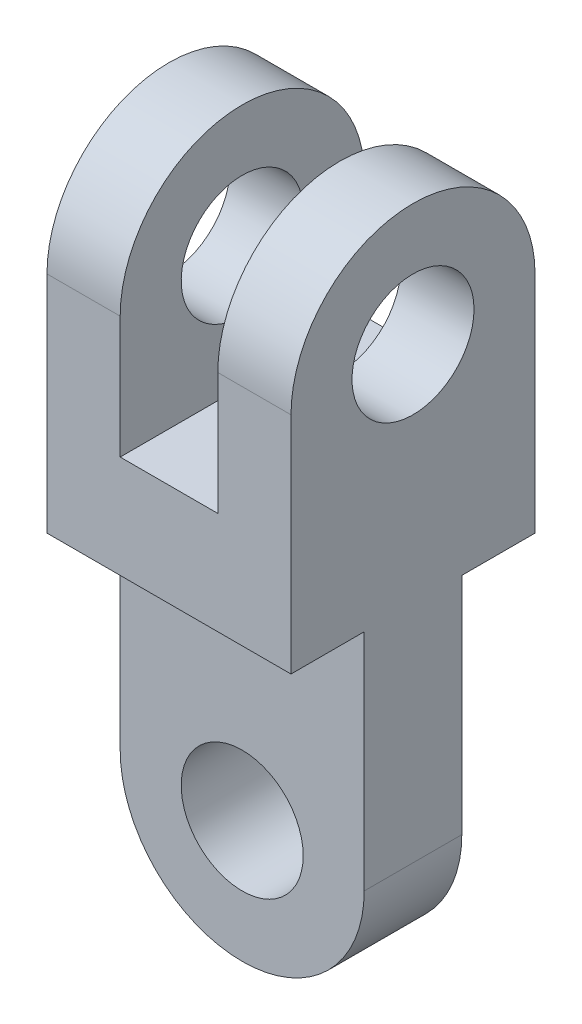
from build123d import *

# Parameters (mm, degrees)
CROQUIS1_R                   = 25
SALIENTE_EXTRUIR1_DEPTH      = 40
SALIENTE_EXTRUIR2_DEPTH      = 30
SALIENTE_EXTRUIR2_DEPTH_BACK = 70
CROQUIS2_W                   = 30
CROQUIS2_H                   = 50
REDONDEO2_RADIUS             = 50
REDONDEO2_LENGTH             = 30
REDONDEO3_RADIUS             = 50
REDONDEO3_LENGTH             = 30
CROQUIS3_R                   = 25
CORTAR_EXTRUIR1_DEPTH        = 264.924231551


with BuildPart() as part:
    # Croquis1 → Saliente-Extruir1 (new body)
    with BuildSketch(Plane.XY):
        with BuildLine():
            Line((-50, 0), (-50, 92))
            Line((-50, 92), (50, 92))
            Line((50, 92), (50, 0))
            ThreePointArc((50, 0), (0, -50), (-50, 0))
        make_face()
        Circle(CROQUIS1_R, mode=Mode.SUBTRACT)
    extrude(amount=-SALIENTE_EXTRUIR1_DEPTH)

    # Croquis2 → Saliente-Extruir2 (add, two sides: drawn at the far end of the back side and taken through both)
    with BuildSketch(Plane.XY.offset(-SALIENTE_EXTRUIR2_DEPTH_BACK)):
        Polygon((50, 184), (50, 92), (-50, 92), (-50, 184), (-20, 184), (-20, 134), (20, 134), (20, 184), align=None)
        with Locations((-35, 209)):
            Rectangle(CROQUIS2_W, CROQUIS2_H)
        with Locations((35, 209)):
            Rectangle(CROQUIS2_W, CROQUIS2_H)
    extrude(amount=SALIENTE_EXTRUIR2_DEPTH + SALIENTE_EXTRUIR2_DEPTH_BACK)

    # Redondeo2: full round fillet: the end face becomes a half cylinder, R = half its width
    redondeo2_face = Plane((-35, 234, -20), x_dir=(1, 0, 0), z_dir=(0, 1, 0))  # on the end face: x along it, z out of the body
    redondeo2_slab = redondeo2_face.offset(-REDONDEO2_RADIUS / 2) * Box(REDONDEO2_LENGTH, 2 * REDONDEO2_RADIUS, REDONDEO2_RADIUS, mode=Mode.PRIVATE)  # the body's end, R deep
    redondeo2_round = Plane((-35, 184, -20), x_dir=(0, 1, 0), z_dir=(1, 0, 0)) * Cylinder(REDONDEO2_RADIUS, REDONDEO2_LENGTH, mode=Mode.PRIVATE)  # its axis R under the face
    add(redondeo2_slab - redondeo2_round, mode=Mode.SUBTRACT)

    # Redondeo3: full round fillet: the end face becomes a half cylinder, R = half its width
    redondeo3_face = Plane((35, 234, -20), x_dir=(1, 0, 0), z_dir=(0, 1, 0))  # on the end face: x along it, z out of the body
    redondeo3_slab = redondeo3_face.offset(-REDONDEO3_RADIUS / 2) * Box(REDONDEO3_LENGTH, 2 * REDONDEO3_RADIUS, REDONDEO3_RADIUS, mode=Mode.PRIVATE)  # the body's end, R deep
    redondeo3_round = Plane((35, 184, -20), x_dir=(0, 1, 0), z_dir=(1, 0, 0)) * Cylinder(REDONDEO3_RADIUS, REDONDEO3_LENGTH, mode=Mode.PRIVATE)  # its axis R under the face
    add(redondeo3_slab - redondeo3_round, mode=Mode.SUBTRACT)

    # Croquis3 → Cortar-Extruir1 (cut, through all)
    with BuildSketch(Plane(origin=(50, 0, 0), x_dir=(0, 0, -1), z_dir=(1, 0, 0))):
        with Locations((20, 184)):
            Circle(CROQUIS3_R)
    extrude(amount=-CORTAR_EXTRUIR1_DEPTH, mode=Mode.SUBTRACT)


solid = part.part
